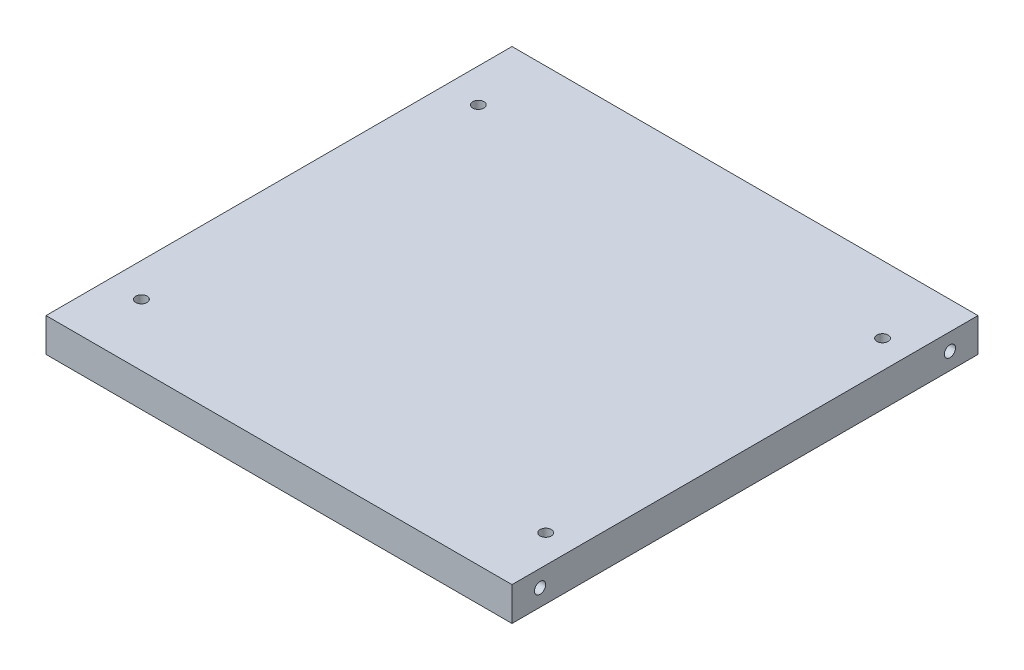
from build123d import *

# Parameters (mm, degrees)
SKETCH1_W            = 83
SKETCH1_H            = 83
BOSS_EXTRUDE1_DEPTH  = 6
SKETCH2_R            = 1
CUT_EXTRUDE1_DEPTH   = 6
LPATTERN1_COUNT      = 2
LPATTERN1_PITCH      = 72
LPATTERN1_COUNT_DIR2 = 2
LPATTERN1_PITCH_DIR2 = 60
SKETCH3_R            = 1
CUT_EXTRUDE2_DEPTH   = 10


with BuildPart() as part:
    # Sketch1 → Boss-Extrude1 (new body)
    with BuildSketch(Plane(origin=(0, 0, 0), x_dir=(1, 0, 0), z_dir=(0, 1, 0))):
        with Locations((41.5, 41.5)):
            Rectangle(SKETCH1_W, SKETCH1_H)
    extrude(amount=BOSS_EXTRUDE1_DEPTH)

    # Sketch2 → Cut-Extrude1 (cut)
    with BuildSketch(Plane(origin=(0, 6, 0), x_dir=(1, 0, 0), z_dir=(0, 1, 0))):
        with Locations(Location((6, 71, 0), (0, 0, 270))):
            Circle(SKETCH2_R)
    cut_extrude1 = extrude(amount=-CUT_EXTRUDE1_DEPTH, mode=Mode.SUBTRACT)

    # LPattern1: Cut-Extrude1 2 × 2
    with Locations(*[(i * LPATTERN1_PITCH, 0, j * LPATTERN1_PITCH_DIR2) for i in range(LPATTERN1_COUNT) for j in range(LPATTERN1_COUNT_DIR2) if (i, j) != (0, 0)]):
        add(cut_extrude1, mode=Mode.SUBTRACT)

    # Sketch3 → Cut-Extrude2 (cut)
    with BuildSketch(Plane.ZY):
        with Locations((-78, 3)):
            Circle(SKETCH3_R)
        with Locations((-5, 3)):
            Circle(SKETCH3_R)
    cut_extrude2 = extrude(amount=-CUT_EXTRUDE2_DEPTH, mode=Mode.SUBTRACT)

    # Mirror1: Cut-Extrude2 across plane
    add(cut_extrude2.mirror(Plane.ZY.offset(-41.5)), mode=Mode.SUBTRACT)


solid = part.part
